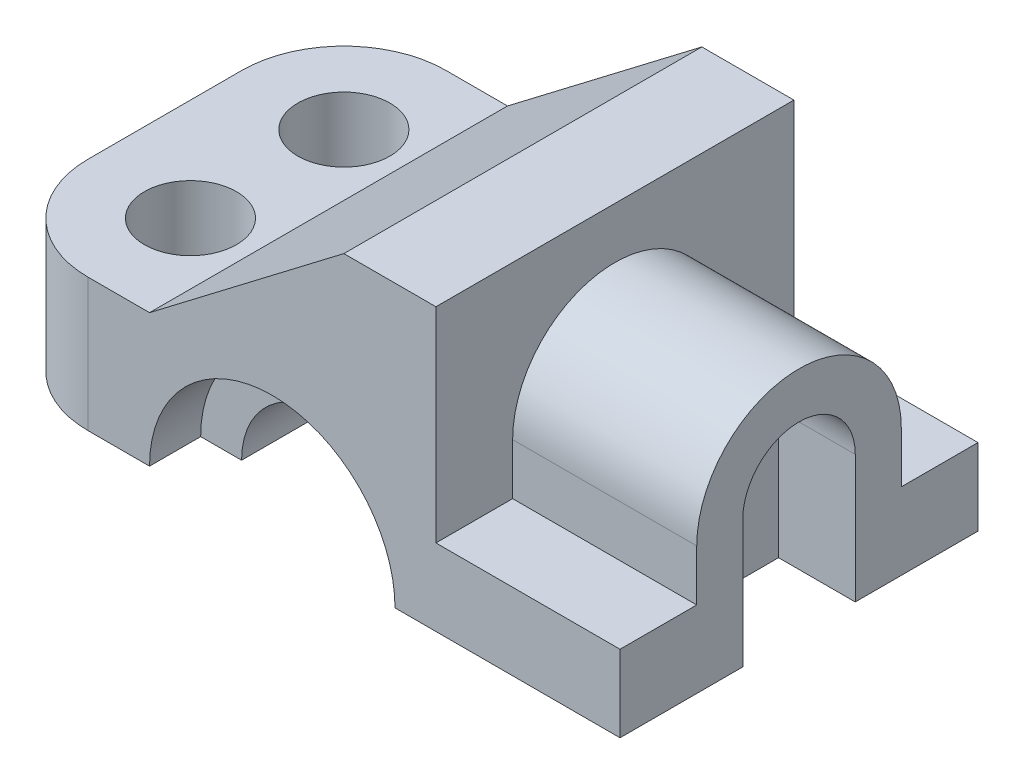
from build123d import *

# Parameters (mm, degrees)
EXTRUDE_1_DEPTH     = 70
FILLET_1_R          = 20
SKETCH_4_R          = 9
CUT_EXTRUDE_1_DEPTH = 146.316895095
CUT_EXTRUDE_2_DEPTH = 10
CUT_EXTRUDE_3_DEPTH = 153.646650799
CUT_EXTRUDE_START   = -10
SKETCH_6_R          = 24
CUT_EXTRUDE_4_DEPTH = 10
EXTRUDE_2_DEPTH     = 36
CUT_EXTRUDE_5_DEPTH = 15


with BuildPart() as part:
    # 草圖3 → 填料-伸長1 (new body)
    with BuildSketch(Plane.XY):
        Polygon((0, 0), (0, 26), (32, 26), (70, 55), (88, 55), (88, 15), (124, 15), (124, 0), (30.697426797, 0), align=None)
    extrude(amount=-EXTRUDE_1_DEPTH)

    # 圓角1
    fillet_1_edges = [part.edges().sort_by_distance(p)[0] for p in [
        (0, 13, -70),
        (0, 13, 0),
    ]]
    fillet(fillet_1_edges, radius=FILLET_1_R)

    # 草圖4 → 除料-伸長1 (cut, through all)
    with BuildSketch(Plane(origin=(0, 26, 0), x_dir=(1, 0, 0), z_dir=(0, 1, 0))):
        with Locations((20, 20)):
            Circle(SKETCH_4_R)
        with Locations((20, 50)):
            Circle(SKETCH_4_R)
    extrude(amount=-CUT_EXTRUDE_1_DEPTH, mode=Mode.SUBTRACT)

    # 草圖5 → 除料-伸長2 (cut)
    with BuildSketch(Plane.XY):
        with BuildLine():
            ThreePointArc((80, 0), (56, 24), (32, 0))
            Line((32, 0), (40, 0))
            ThreePointArc((40, 0), (56, 16), (72, 0))
            Line((72, 0), (80, 0))
        make_face()
    extrude(amount=-CUT_EXTRUDE_2_DEPTH, mode=Mode.SUBTRACT)

    # 草圖5<3> → 除料-伸長3 (cut, through all)
    with BuildSketch(Plane.XY):
        with BuildLine():
            ThreePointArc((72, 0), (56, 16), (40, 0))
            Line((40, 0), (72, 0))
        make_face()
    extrude(amount=-CUT_EXTRUDE_3_DEPTH, mode=Mode.SUBTRACT)

    # 草圖6 → 除料-伸長4 (cut)
    with BuildSketch(Plane(origin=(0, 0, -70), x_dir=(-1, 0, 0), z_dir=(0, 0, -1)).offset(CUT_EXTRUDE_START)):
        with Locations((-56, 0)):
            Circle(SKETCH_6_R)
    extrude(amount=CUT_EXTRUDE_4_DEPTH, mode=Mode.SUBTRACT)

    # 草圖7 → 填料-伸長2 (add)
    with BuildSketch(Plane(origin=(88, 0, 0), x_dir=(0, 0, -1), z_dir=(1, 0, 0))):
        with BuildLine():
            Line((15, 15), (55, 15))
            Line((55, 15), (55, 25))
            ThreePointArc((55, 25), (35, 45), (15, 25))
            Line((15, 25), (15, 15))
        make_face()
    extrude(amount=EXTRUDE_2_DEPTH)

    # 草圖8 → 除料-伸長5 (cut)
    with BuildSketch(Plane(origin=(124, 0, 0), x_dir=(0, 0, -1), z_dir=(1, 0, 0))):
        with BuildLine():
            Line((24, 0), (24, 25))
            ThreePointArc((24, 25), (35, 36), (46, 25))
            Line((46, 25), (46, 0))
            Line((46, 0), (24, 0))
        make_face()
    extrude(amount=-CUT_EXTRUDE_5_DEPTH, mode=Mode.SUBTRACT)


solid = part.part
